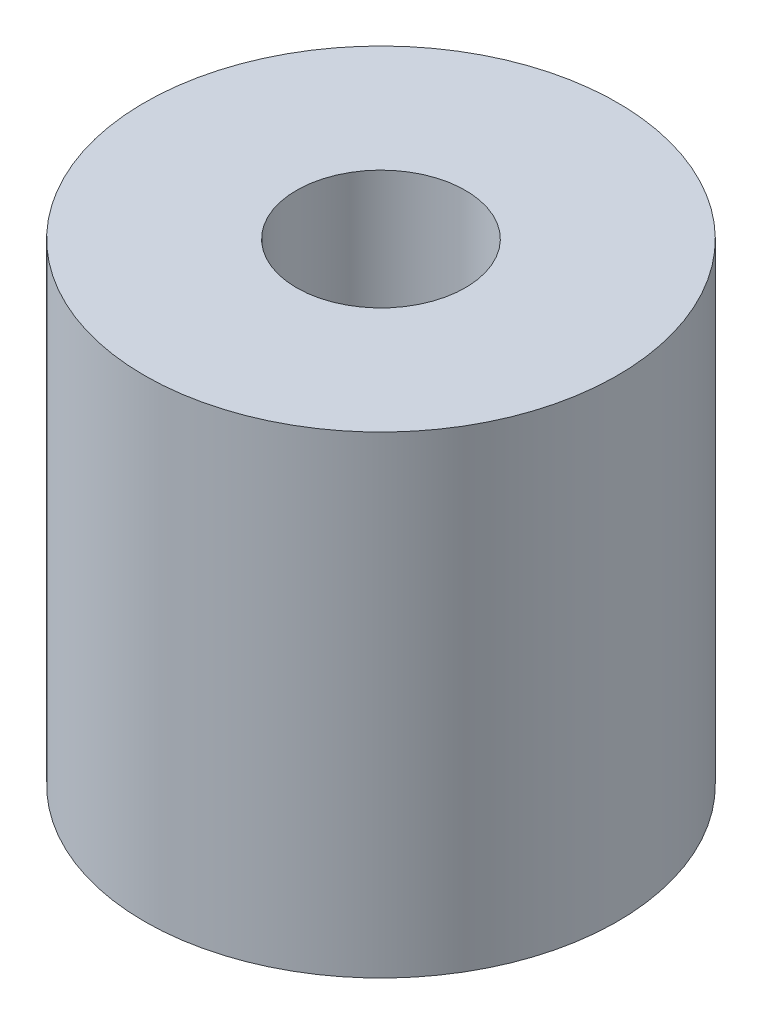
from build123d import *

# Parameters (mm, degrees)
SKETCH1_R           = 7
SKETCH1_R_2         = 2.5
BOSS_EXTRUDE1_DEPTH = 14


with BuildPart() as part:
    # Sketch1 → Boss-Extrude1 (new body)
    with BuildSketch(Plane(origin=(0, 0, 0), x_dir=(1, 0, 0), z_dir=(0, 1, 0))):
        with Locations(Location((0, 0, 0), (0, 0, 270))):
            Circle(SKETCH1_R)
        with Locations(Location((0, 0, 0), (0, 0, 270))):
            Circle(SKETCH1_R_2, mode=Mode.SUBTRACT)
    extrude(amount=BOSS_EXTRUDE1_DEPTH)


solid = part.part
